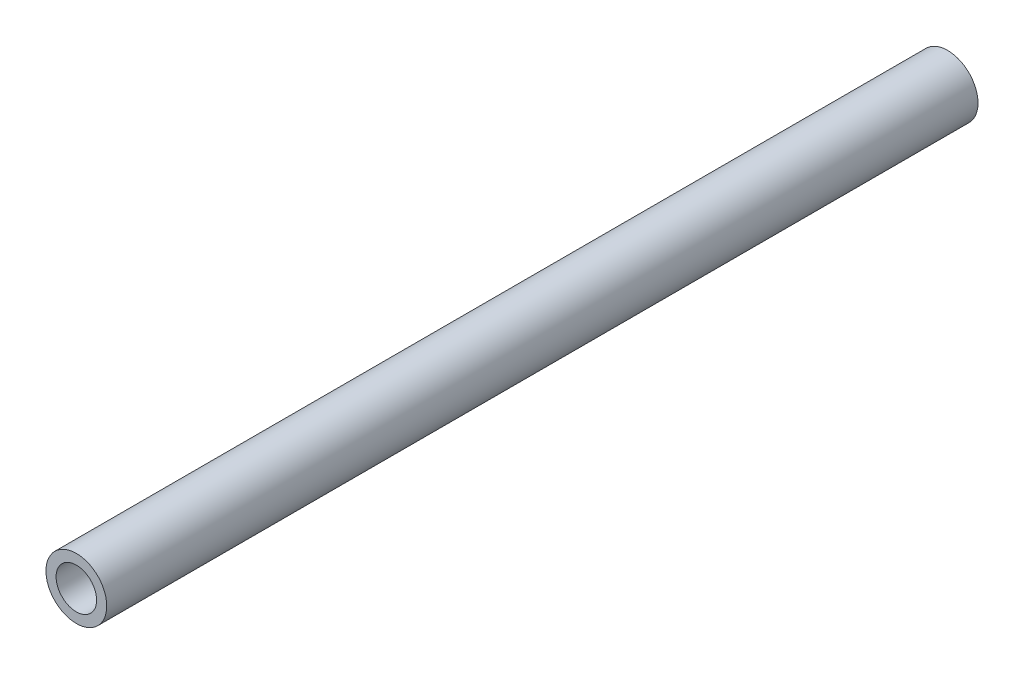
from build123d import *

# Parameters (mm, degrees)
SKETCH_1_R      = 3
SKETCH_1_R_2    = 2
EXTRUDE_1_DEPTH = 86


with BuildPart() as part:
    # Эскиз1 → Вытянуть1 (new body)
    with BuildSketch(Plane.XY):
        Circle(SKETCH_1_R)
        Circle(SKETCH_1_R_2, mode=Mode.SUBTRACT)
    extrude(amount=EXTRUDE_1_DEPTH)


solid = part.part
